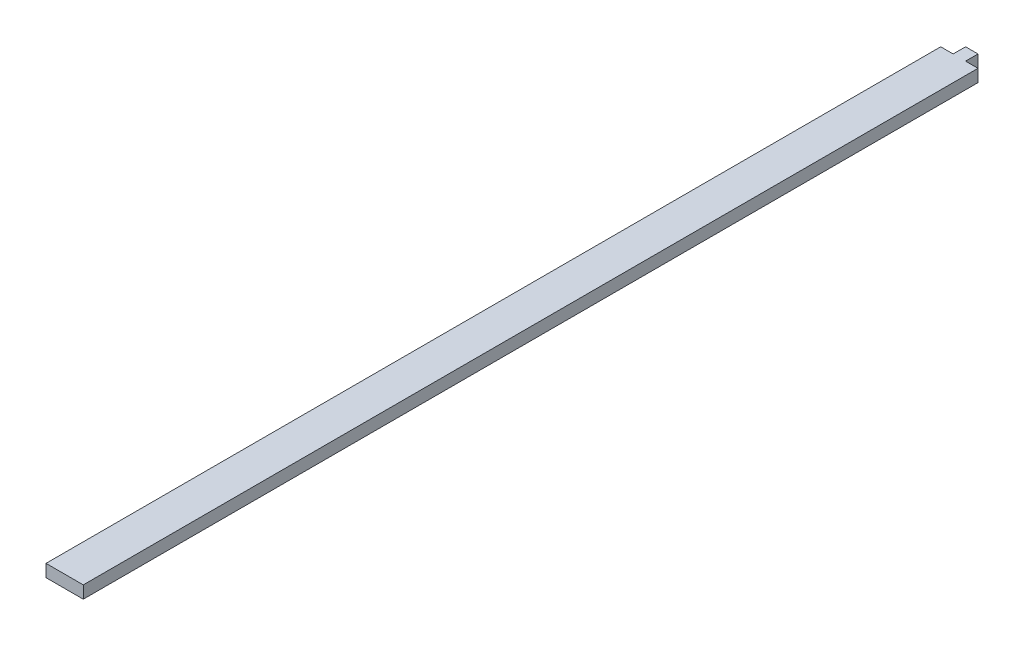
from build123d import *

# Parameters (mm, degrees)
SKETCH1_W           = 19.05
SKETCH1_H           = 457.2
SKETCH1_W_2         = 6.35
SKETCH1_H_2         = 6.35
BOSS_EXTRUDE1_DEPTH = 6.35


with BuildPart() as part:
    # Sketch1 → Boss-Extrude1 (new body)
    with BuildSketch(Plane(origin=(0, 0, 0), x_dir=(1, 0, 0), z_dir=(0, 1, 0))):
        with Locations((9.525, 228.6)):
            Rectangle(SKETCH1_W, SKETCH1_H)
        with Locations((9.525, 460.375)):
            Rectangle(SKETCH1_W_2, SKETCH1_H_2)
    extrude(amount=BOSS_EXTRUDE1_DEPTH)


solid = part.part
